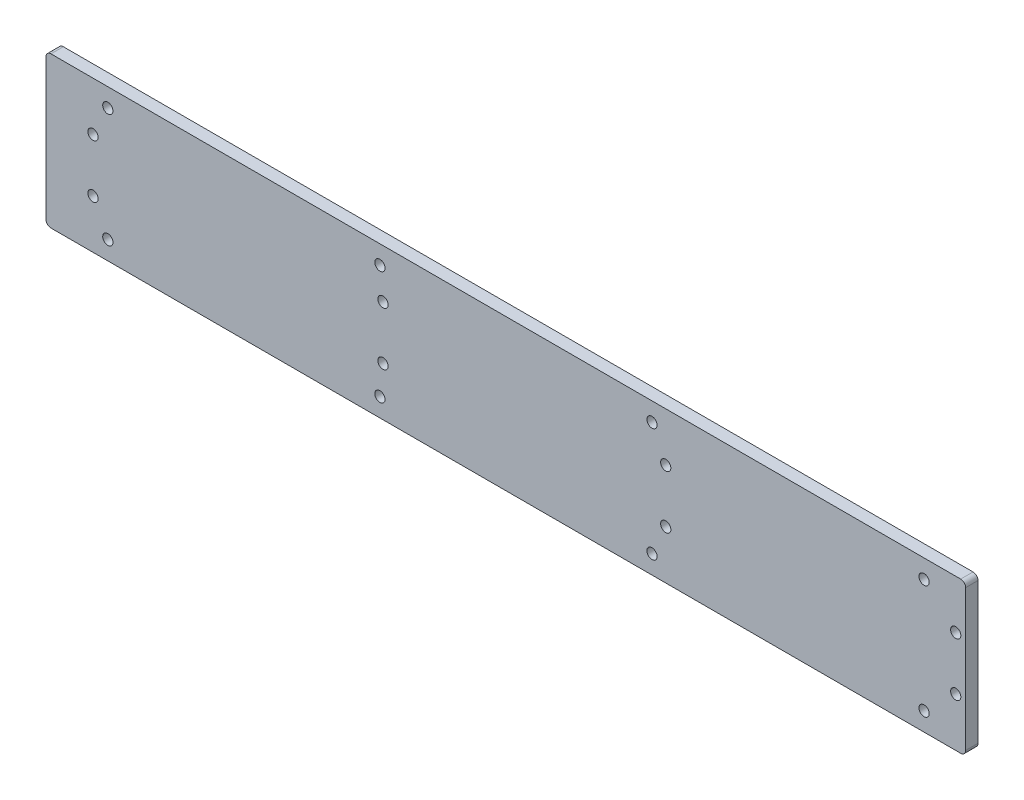
from build123d import *

# Parameters (mm, degrees)
SALIENTE_EXTRUIR1_DEPTH = 6.35
CROQUIS4_R              = 2.63125
CORTAR_EXTRUIR2_DEPTH   = 249.734647062
CROQUIS5_R              = 2.63125
CORTAR_EXTRUIR3_DEPTH   = 249.734647062
REDONDEO1_R             = 2.54


with BuildPart() as part:
    # Croquis2 → Saliente-Extruir1 (new body)
    with BuildSketch(Plane.XY):
        Polygon((-245.618, -38.735), (-245.618, 38.735), (226.568, 38.735), (226.568, 19.685), (226.568, -19.685), (226.568, -38.735), align=None)
    extrude(amount=SALIENTE_EXTRUIR1_DEPTH)

    # Croquis4 → Cortar-Extruir2 (cut, through all)
    with BuildSketch(Plane.XY.offset(6.35)):
        with Locations((-221.488, 13.68025)):
            Circle(CROQUIS4_R)
        with Locations((-221.488, -13.68025)):
            Circle(CROQUIS4_R)
        with Locations(Location((221.488, -13.68025, 0), (0, 0, 180))):
            Circle(CROQUIS4_R)
        with Locations(Location((221.488, 13.68025, 0), (0, 0, 180))):
            Circle(CROQUIS4_R)
        with Locations((-72.588782178, 13.68025)):
            Circle(CROQUIS4_R)
        with Locations(Location((-72.588782178, -13.68025, 0), (0, 0, 180))):
            Circle(CROQUIS4_R)
        with Locations((72.588782178, 13.68025)):
            Circle(CROQUIS4_R)
        with Locations(Location((72.588782178, -13.68025, 0), (0, 0, 180))):
            Circle(CROQUIS4_R)
    extrude(amount=-CORTAR_EXTRUIR2_DEPTH, mode=Mode.SUBTRACT)

    # Croquis5 → Cortar-Extruir3 (cut, through all)
    with BuildSketch(Plane.XY.offset(6.35)):
        with Locations((-213.868, 29.21)):
            Circle(CROQUIS5_R)
        with Locations((-74.168, 29.21)):
            Circle(CROQUIS5_R)
        with Locations((65.532, 29.21)):
            Circle(CROQUIS5_R)
        with Locations((205.232, 29.21)):
            Circle(CROQUIS5_R)
        with Locations(Location((205.232, -29.21, 0), (0, 0, 180))):
            Circle(CROQUIS5_R)
        with Locations(Location((65.532, -29.21, 0), (0, 0, 180))):
            Circle(CROQUIS5_R)
        with Locations(Location((-74.168, -29.21, 0), (0, 0, 180))):
            Circle(CROQUIS5_R)
        with Locations(Location((-213.868, -29.21, 0), (0, 0, 180))):
            Circle(CROQUIS5_R)
    extrude(amount=-CORTAR_EXTRUIR3_DEPTH, mode=Mode.SUBTRACT)

    # Redondeo1
    redondeo1_edges = [part.edges().sort_by_distance(p)[0] for p in [
        (226.568, -38.735, 3.175),
        (-245.618, -38.735, 3.175),
        (-245.618, 38.735, 3.175),
        (226.568, 38.735, 3.175),
    ]]
    fillet(redondeo1_edges, radius=REDONDEO1_R)


solid = part.part
